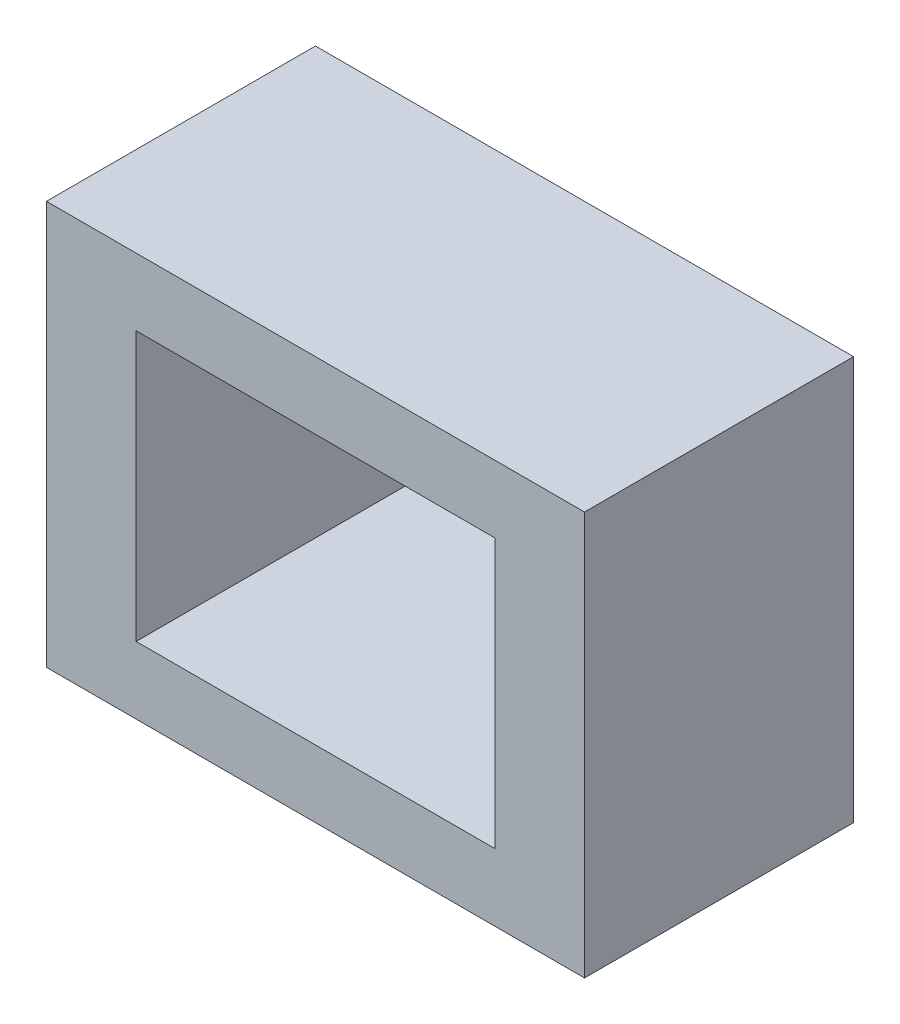
from build123d import *

# Parameters (mm, degrees)
SKETCH_1_W      = 600
SKETCH_1_H      = 450
SKETCH_1_W_2    = 400
SKETCH_1_H_2    = 300
EXTRUDE_2_DEPTH = 150


with BuildPart() as part:
    # 草图1 → 凸台-拉伸2 (new, symmetric)
    with BuildSketch(Plane.XY):
        Rectangle(SKETCH_1_W, SKETCH_1_H)
        Rectangle(SKETCH_1_W_2, SKETCH_1_H_2, mode=Mode.SUBTRACT)
    extrude(amount=EXTRUDE_2_DEPTH, both=True)


solid = part.part
